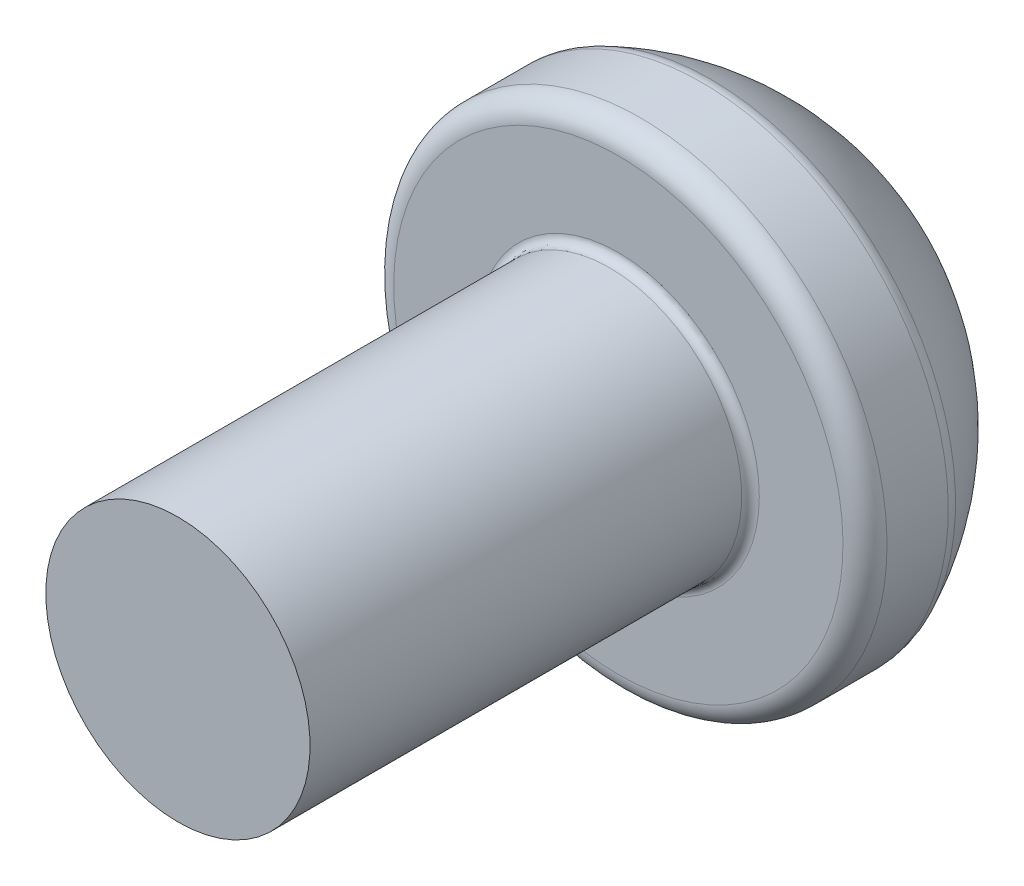
from build123d import *

# Parameters (mm, degrees)
FILLET1_R          = 0.1
FILLET2_R          = 0.25
HOLE1_D            = 2.05
HOLE1_DEPTH        = 1
HOLE1_TIP          = 0.37306949
CUT_EXTRUDE1_DEPTH = 1


with BuildPart() as part:
    # Sketch1 → Base-Revolve (revolve)
    with BuildSketch(Plane(origin=(0, 0, 0), x_dir=(0, 0, -1), z_dir=(1, 0, 0))):
        with BuildLine():
            Line((-5, 0), (-5, 1.5))
            Line((-5, 1.5), (0, 1.5))
            Line((0, 1.5), (0, 2.8))
            Line((0, 2.8), (1, 2.8))
            ThreePointArc((1, 2.8), (1.799098682, 2.280109646), (2.4, 1.54))
            Line((2.4, 1.54), (2.4, 0))
            Line((2.4, 0), (-5, 0))
        make_face()
    revolve(axis=Axis((0, 0, -2.4), (0, 0, 1)))

    # Fillet1
    fillet1_edges = [part.edges().sort_by_distance(p)[0] for p in [
        (0, -1.5, 0),
    ]]
    fillet(fillet1_edges, radius=FILLET1_R)

    # Fillet2
    fillet2_edges = [part.edges().sort_by_distance(p)[0] for p in [
        (0, -2.8, -1),
        (0, -2.8, 0),
    ]]
    fillet(fillet2_edges, radius=FILLET2_R)

    # Hole1
    with Locations(Plane(origin=(0, 0, -2.4), x_dir=(-1, 0, 0), z_dir=(0, 0, -1))):
        with Locations((0, 0)):
            Hole(HOLE1_D / 2, depth=HOLE1_DEPTH)
            with Locations((0, 0, -(HOLE1_DEPTH + HOLE1_TIP / 2))):  # 140° drill point
                Cone(0, HOLE1_D / 2, HOLE1_TIP, mode=Mode.SUBTRACT)

    # Sketch4 → Cut-Extrude1 (cut)
    with BuildSketch(Plane(origin=(0, 0, -2.4), x_dir=(-1, 0, 0), z_dir=(0, 0, -1))):
        with BuildLine():
            ThreePointArc((1.088832331, -0.880025088), (1.212435565, -0.7), (1.306540248, -0.502943915))
            ThreePointArc((1.306540248, -0.502943915), (1.025, 0), (1.306540248, 0.502943915))
            ThreePointArc((1.306540248, 0.502943915), (1.212435565, 0.7), (1.088832331, 0.880025088))
            ThreePointArc((1.088832331, 0.880025088), (0.5125, 0.887676039), (0.217707917, 1.382969003))
            ThreePointArc((0.217707917, 1.382969003), (0, 1.4), (-0.217707917, 1.382969003))
            ThreePointArc((-0.217707917, 1.382969003), (-0.5125, 0.887676039), (-1.088832331, 0.880025088))
            ThreePointArc((-1.088832331, 0.880025088), (-1.212435565, 0.7), (-1.306540248, 0.502943915))
            ThreePointArc((-1.306540248, 0.502943915), (-1.025, 0), (-1.306540248, -0.502943915))
            ThreePointArc((-1.306540248, -0.502943915), (-1.212435565, -0.7), (-1.088832331, -0.880025088))
            ThreePointArc((-1.088832331, -0.880025088), (-0.5125, -0.887676039), (-0.217707917, -1.382969003))
            ThreePointArc((-0.217707917, -1.382969003), (0, -1.4), (0.217707917, -1.382969003))
            ThreePointArc((0.217707917, -1.382969003), (0.5125, -0.887676039), (1.088832331, -0.880025088))
        make_face()
    extrude(amount=-CUT_EXTRUDE1_DEPTH, mode=Mode.SUBTRACT)


solid = part.part
